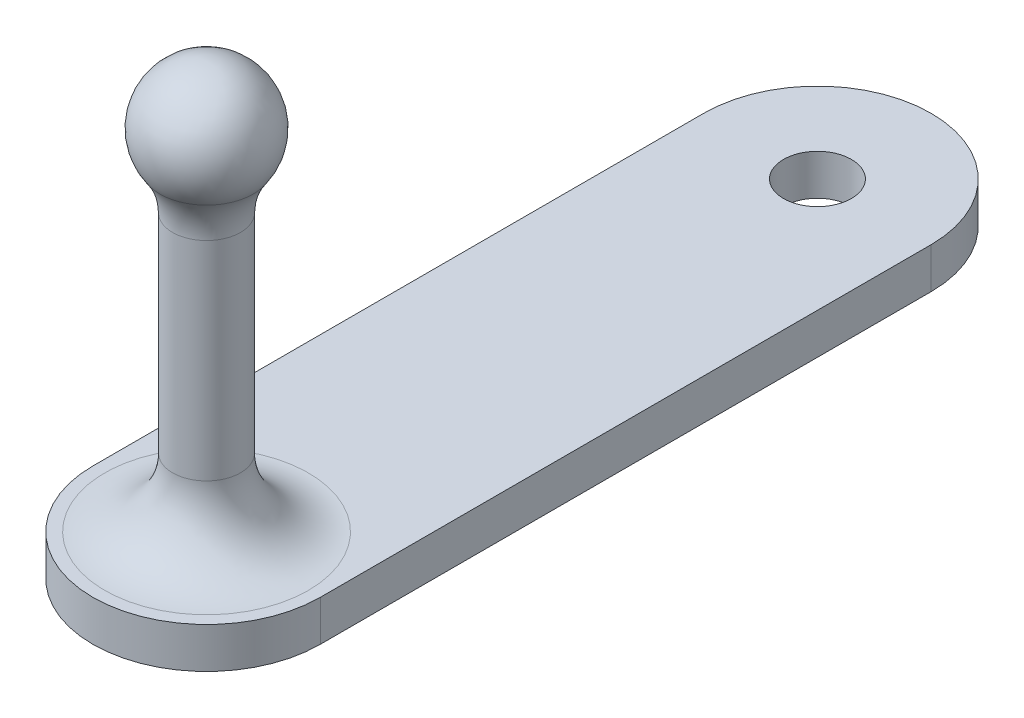
from build123d import *

# Parameters (mm, degrees)
SKETCH3_R           = 2.5
BOSS_EXTRUDE1_DEPTH = 3
FILLET1_R           = 5


with BuildPart() as part:
    # Sketch1 → Revolve1 (revolve)
    with BuildSketch(Plane.XY, mode=Mode.PRIVATE) as revolve1_sk:
        with BuildLine():
            Line((0, 4.25), (0, -25.75))
            Line((0, -25.75), (-2.5, -25.75))
            Line((-2.5, -25.75), (-2.5, -3.436931771))
            ThreePointArc((-2.5, -3.436931771), (-4.041624675, 1.314446646), (0, 4.25))
        make_face()
    revolve(revolve1_sk.sketch.rotate(Axis((0, 4.25, 0), (0, -1, 0)), 180), axis=Axis((0, 4.25, 0), (0, -1, 0)))

    # Sketch3 → Boss-Extrude1 (add)
    with BuildSketch(Plane(origin=(0, -25.75, 0), x_dir=(-1, 0, 0), z_dir=(0, -1, 0))):
        with BuildLine():
            Line((8.378284652, 45), (8.378284652, 0))
            ThreePointArc((8.378284652, 0), (0, -8.378284652), (-8.378284652, 0))
            Line((-8.378284652, 0), (-8.378284652, 45))
            ThreePointArc((-8.378284652, 45), (0, 53.378284652), (8.378284652, 45))
        make_face()
        with Locations(Location((0, 45, 0), (0, 0, 180))):
            Circle(SKETCH3_R, mode=Mode.SUBTRACT)
    extrude(amount=BOSS_EXTRUDE1_DEPTH)

    # Fillet1
    fillet1_edges = [part.edges().sort_by_distance(p)[0] for p in [
        (-2.5, -25.75, 0),
        (-2.5, -3.436931771, 0),
    ]]
    fillet(fillet1_edges, radius=FILLET1_R)


solid = part.part
